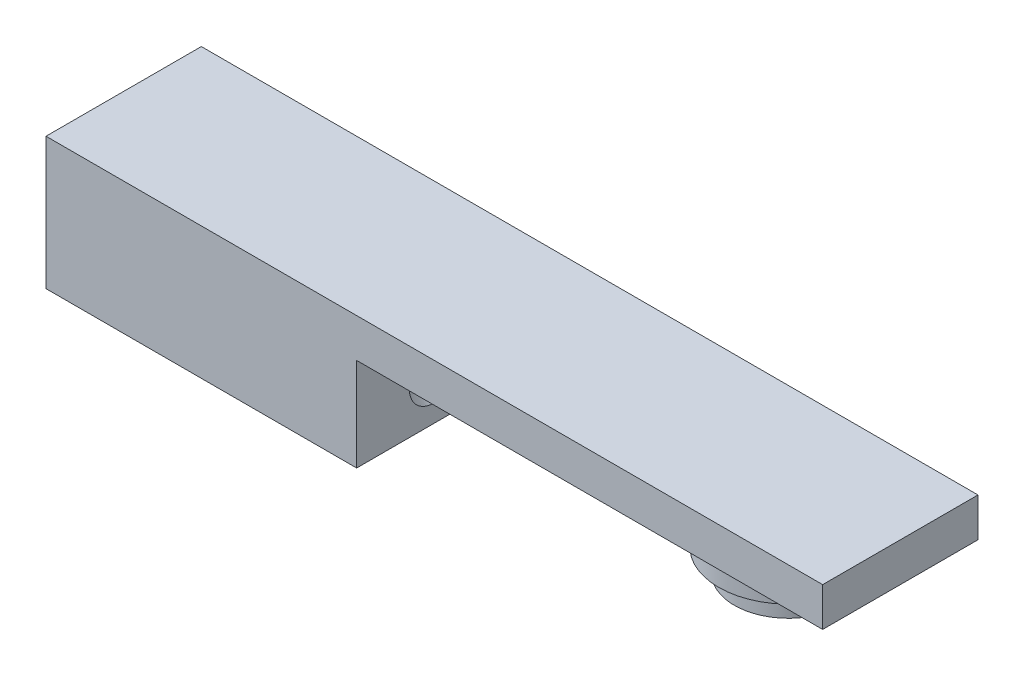
from build123d import *

# Parameters (mm, degrees)
SKETCH_1_W      = 20
SKETCH_1_H      = 17
EXTRUDE_1_DEPTH = 40
SKETCH_2_W      = 20
SKETCH_2_H      = 5
EXTRUDE_2_DEPTH = 60
SKETCH_3_R      = 9
EXTRUDE_3_DEPTH = 3
SKETCH_4_R      = 7
EXTRUDE_4_DEPTH = 3


with BuildPart() as part:
    # Эскиз1 → Бобышка-Вытянуть1 (new body)
    with BuildSketch(Plane(origin=(0, 0, 0), x_dir=(0, 0, -1), z_dir=(1, 0, 0))):
        with Locations((-27.72412662, 10.860988518)):
            Rectangle(SKETCH_1_W, SKETCH_1_H)
    extrude(amount=EXTRUDE_1_DEPTH)

    # Эскиз2 → Бобышка-Вытянуть2 (add)
    with BuildSketch(Plane(origin=(40, 0, 0), x_dir=(0, 0, -1), z_dir=(1, 0, 0))):
        with Locations((-27.72412662, 16.860988518)):
            Rectangle(SKETCH_2_W, SKETCH_2_H)
    extrude(amount=EXTRUDE_2_DEPTH)

    # Эскиз3 → Бобышка-Вытянуть3 (add)
    with BuildSketch(Plane.XZ.offset(-14.360988518)):
        with Locations(Location((85.620234383, 27.72412662, 0), (0, 0, 90))):
            Circle(SKETCH_3_R)
    extrude(amount=EXTRUDE_3_DEPTH)

    # Эскиз4 → Бобышка-Вытянуть4 (add)
    with BuildSketch(Plane.XZ.offset(-11.360988518)):
        with Locations(Location((85.620234383, 27.72412662, 0), (0, 0, 270))):
            Circle(SKETCH_4_R)
    extrude(amount=EXTRUDE_4_DEPTH)

    # Эскиз15 → Зенковка для винта с полупотайной головкой M32 (revolve, cut)
    with BuildSketch(Plane(origin=(40, 7.784111953, 27.791024889), x_dir=(0, 0, -1), z_dir=(0, 1, 0))):
        Polygon((0, 0), (0, 40), (1.7, 40), (1.7, 1.45), (3.15, 0), align=None)
    revolve(axis=Axis((46.35, 7.784111953, 27.791024889), (-1, 0, 0)), mode=Mode.SUBTRACT)


solid = part.part
